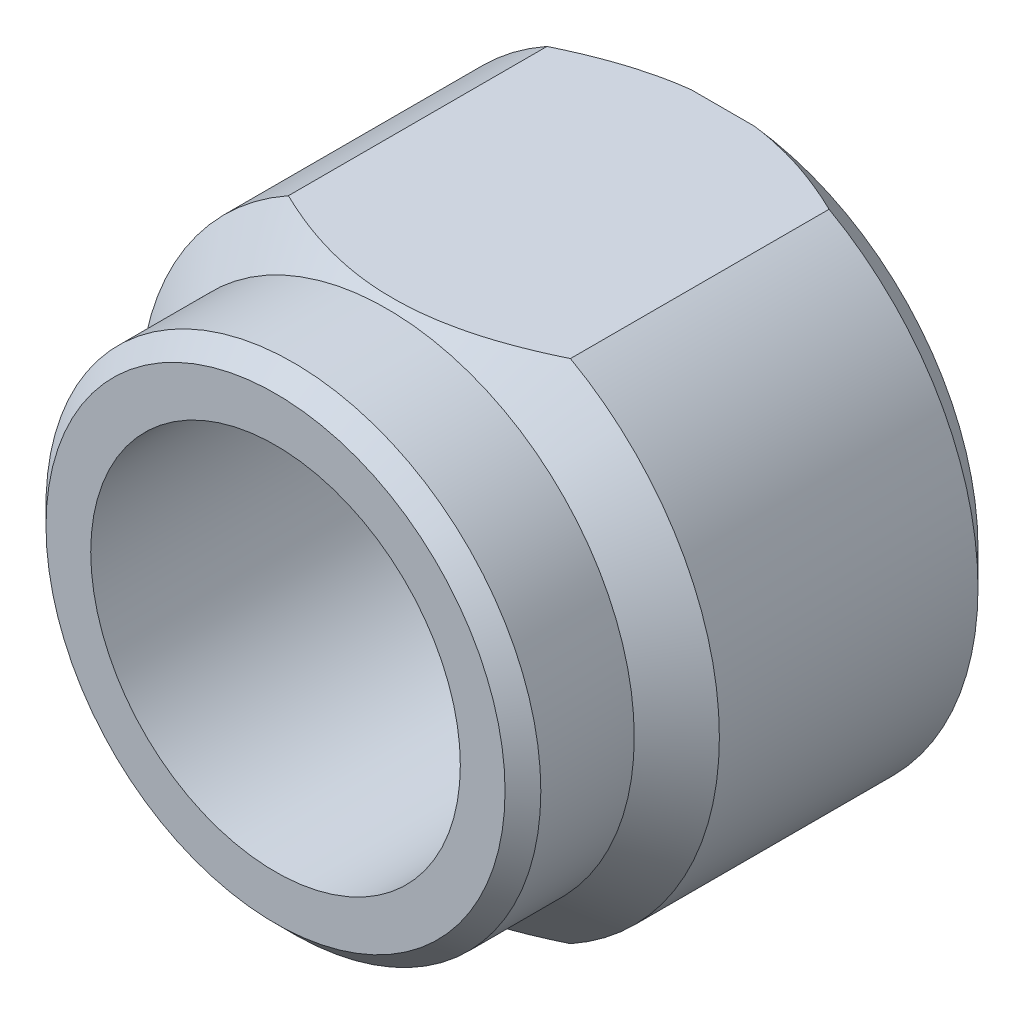
from build123d import *

# Parameters (mm, degrees)
CUT_EXTRUDE1_DEPTH      = 3.1
CUT_EXTRUDE1_DEPTH_BACK = 3.1
SKETCH3_W               = 24
SKETCH3_H               = 12
SKETCH3_W_2             = 20
SKETCH3_H_2             = 8.5
CUT_EXTRUDE2_DEPTH      = 7.5


with BuildPart() as part:
    # Sketch1 → Revolve1 (revolve)
    with BuildSketch(Plane(origin=(0, 0, 0), x_dir=(0, 0, -1), z_dir=(1, 0, 0))):
        Polygon((-2.3, 0), (-2.3, 3.1), (-7.5, 3.1), (-7.5, 3.85), (-7.2, 4.15), (-5.633, 4.15), (-4.919, 4.864), (-0.581, 4.864), (0, 4.283), (0, 0), align=None)
    revolve(axis=Axis((0, 0, 0), (0, 0, 1)))

    # Sketch2 → Cut-Extrude1 (cut, two sides: drawn at the far end of the back side and taken through both)
    with BuildSketch(Plane(origin=(0, 0, 0), x_dir=(0, 0, -1), z_dir=(1, 0, 0)).offset(-CUT_EXTRUDE1_DEPTH_BACK)):
        Polygon((-1.5, -0.368767005), (0, -0.5), (0, 0.5), (-1.5, 0.368767005), align=None)
    extrude(amount=CUT_EXTRUDE1_DEPTH + CUT_EXTRUDE1_DEPTH_BACK, mode=Mode.SUBTRACT)

    # Sketch3 → Cut-Extrude2 (cut)
    with BuildSketch(Plane.XY):
        Rectangle(SKETCH3_W, SKETCH3_H)
        Rectangle(SKETCH3_W_2, SKETCH3_H_2, mode=Mode.SUBTRACT)
    extrude(amount=CUT_EXTRUDE2_DEPTH, mode=Mode.SUBTRACT)


solid = part.part
